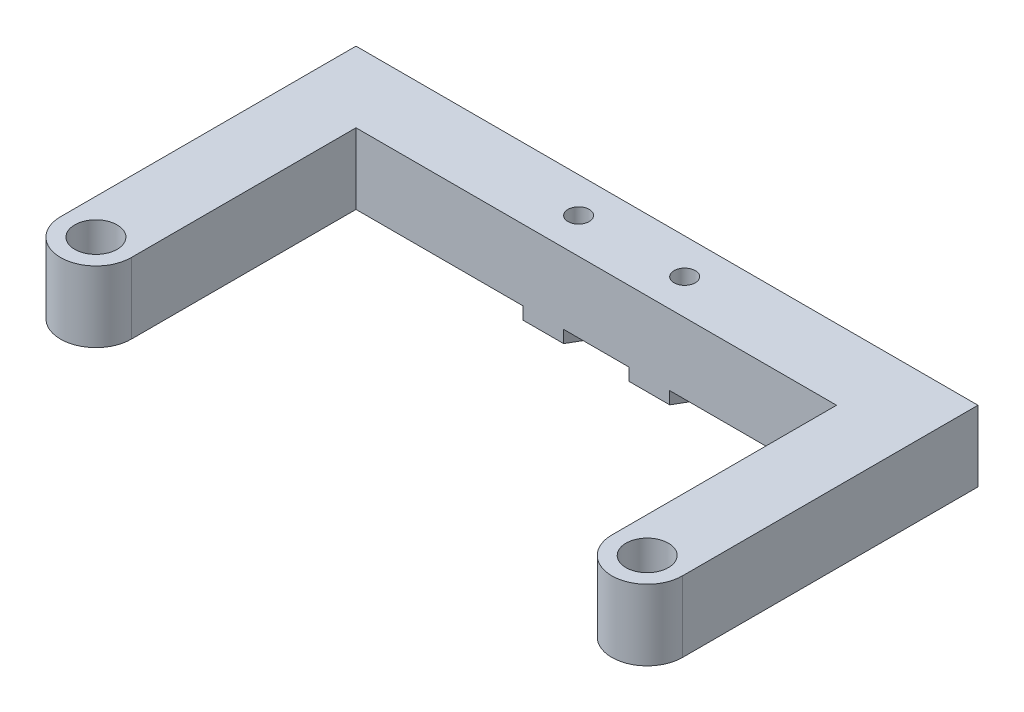
from build123d import *

# Parameters (mm, degrees)
SKETCH1_R           = 1.5
BOSS_EXTRUDE1_DEPTH = 10
BOSS_EXTRUDE2_DEPTH = 1.75
SKETCH3_R           = 3
CUT_EXTRUDE1_DEPTH  = 5


with BuildPart() as part:
    # Sketch1 → Boss-Extrude1 (new body)
    with BuildSketch(Plane(origin=(0, 0, 0), x_dir=(1, 0, 0), z_dir=(0, 1, 0))):
        with BuildLine():
            ThreePointArc((-43.97114317, 22.5), (-38.97114317, 17.5), (-33.97114317, 22.5))
            Line((-33.97114317, 22.5), (-33.97114317, 54.272052467))
            Line((-33.97114317, 54.272052467), (33.97114317, 54.272052467))
            Line((33.97114317, 54.272052467), (33.97114317, 22.5))
            ThreePointArc((33.97114317, 22.5), (38.97114317, 17.5), (43.97114317, 22.5))
            Line((43.97114317, 22.5), (43.97114317, 64.272052467))
            Line((43.97114317, 64.272052467), (-43.97114317, 64.272052467))
            Line((-43.97114317, 64.272052467), (-43.97114317, 22.5))
        make_face()
        with Locations(Location((-38.97114317, 22.5, 0), (0, 0, 270))):
            Circle(SKETCH1_R, mode=Mode.SUBTRACT)
        with Locations(Location((38.97114317, 22.5, 0), (0, 0, 270))):
            Circle(SKETCH1_R, mode=Mode.SUBTRACT)
        with Locations(Location((7.5, 59.272052467, 0), (0, 0, 270))):
            Circle(SKETCH1_R, mode=Mode.SUBTRACT)
        with Locations(Location((-7.5, 59.272052467, 0), (0, 0, 270))):
            Circle(SKETCH1_R, mode=Mode.SUBTRACT)
    extrude(amount=BOSS_EXTRUDE1_DEPTH)

    # Sketch2 → Boss-Extrude2 (add)
    # profile 1 of 2: a face of its own
    with BuildSketch(Plane.XZ):
        Polygon((-1.726497308, -59.272052467), (-4.613248654, -54.272052467), (-10.386751346, -54.272052467), (-13.273502692, -59.272052467), (-10.386751346, -64.272052467), (-4.613248654, -64.272052467), align=None)
        Polygon((-9.232050808, -56.272052467), (-5.767949192, -56.272052467), (-4.035898385, -59.272052467), (-5.767949192, -62.272052467), (-9.232050808, -62.272052467), (-10.964101615, -59.272052467), align=None, mode=Mode.SUBTRACT)
    # profile 2 of 2: a face of its own
    with BuildSketch(Plane.XZ):
        Polygon((10.386751346, -54.272052467), (4.613248654, -54.272052467), (1.726497308, -59.272052467), (4.613248654, -64.272052467), (10.386751346, -64.272052467), (13.273502692, -59.272052467), align=None)
        Polygon((5.767949192, -56.272052467), (9.232050808, -56.272052467), (10.964101615, -59.272052467), (9.232050808, -62.272052467), (5.767949192, -62.272052467), (4.035898385, -59.272052467), align=None, mode=Mode.SUBTRACT)
    extrude(amount=BOSS_EXTRUDE2_DEPTH)

    # Sketch3 → Cut-Extrude1 (cut)
    with BuildSketch(Plane(origin=(0, 10, 0), x_dir=(1, 0, 0), z_dir=(0, 1, 0))):
        with Locations(Location((-38.97114317, 22.5, 0), (0, 0, 270))):
            Circle(SKETCH3_R)
        with Locations(Location((38.97114317, 22.5, 0), (0, 0, 270))):
            Circle(SKETCH3_R)
    extrude(amount=-CUT_EXTRUDE1_DEPTH, mode=Mode.SUBTRACT)


solid = part.part
